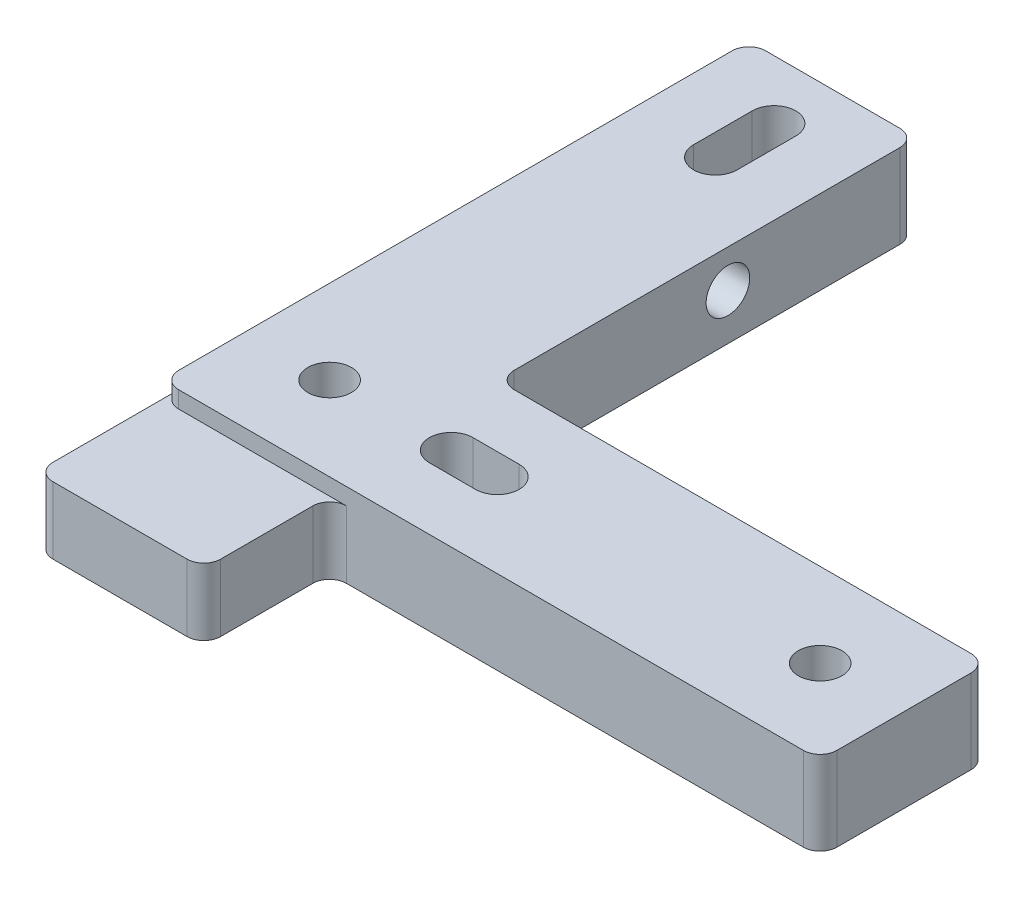
from build123d import *

# Parameters (mm, degrees)
SKETCH1_R                          = 2.6
BOSS_EXTRUDE1_DEPTH                = 10
SKETCH4_R                          = 2.6
MOTOR_TENSIONING_HOLE_DEPTH        = 106.651549918
SKETCH10_W                         = 20
SKETCH10_H                         = 15
BOSS_EXTRUDE3_DEPTH                = 10
FILLET1_R                          = 2
CHAMFER2_SIZE                      = 12
CHAMFER2_SIZE2                     = 1.049863962
M5_SLOTS_FOR_ALTERNATE_PLATE_DEPTH = 106.651549918
SKETCH9_W                          = 2.238782051
SKETCH9_H                          = 0.597008547
CUT_EXTRUDE3_DEPTH                 = 0.4
SKETCH14_W                         = 22
SKETCH14_H                         = 15
CUT_EXTRUDE7_DEPTH                 = 2
FILLET4_R                          = 2


with BuildPart() as part:
    # Sketch1 → Boss-Extrude1 (new body)
    with BuildSketch(Plane(origin=(0, 0, 0), x_dir=(1, 0, 0), z_dir=(0, 1, 0))):
        Polygon((0, 0), (78.5, 0), (78.5, 20), (20, 20), (20, 70), (0, 70), align=None)
        with Locations(Location((10, 56, 0), (0, 0, 270))):
            Circle(SKETCH1_R, mode=Mode.SUBTRACT)
        with Locations(Location((68.5, 10, 0), (0, 0, 270))):
            Circle(SKETCH1_R, mode=Mode.SUBTRACT)
        with Locations(Location((10, 10, 0), (0, 0, 270))):
            Circle(SKETCH1_R, mode=Mode.SUBTRACT)
        with Locations(Location((30, 10, 0), (0, 0, 270))):
            Circle(SKETCH1_R, mode=Mode.SUBTRACT)
    extrude(amount=BOSS_EXTRUDE1_DEPTH)

    # Sketch4 → motor tensioning hole (cut, through all)
    with BuildSketch(Plane.ZY):
        with Locations((-47.5, 5.5)):
            Circle(SKETCH4_R)
    extrude(amount=-MOTOR_TENSIONING_HOLE_DEPTH, mode=Mode.SUBTRACT)

    # Sketch10 → Boss-Extrude3 (add)
    with BuildSketch(Plane(origin=(0, 10, 0), x_dir=(1, 0, 0), z_dir=(0, 1, 0))):
        with Locations((10, -7.5)):
            Rectangle(SKETCH10_W, SKETCH10_H)
    extrude(amount=-BOSS_EXTRUDE3_DEPTH)

    # Fillet1
    fillet1_edges = [part.edges().sort_by_distance(p)[0] for p in [
        (0, 5, -70),
        (20, 5, -70),
        (20, 5, -20),
        (78.5, 5, -20),
        (78.5, 5, 0),
        (0, 5, 15),
        (20, 5, 0),
        (20, 5, 15),
    ]]
    fillet(fillet1_edges, radius=FILLET1_R)

    # Chamfer2
    chamfer2_edges = [part.edges().sort_by_distance(p)[0] for p in [
        (0, 5.5, -50.1),
    ]]
    chamfer2_side = [part.faces().sort_by_distance(p)[0] for p in [
        (10, 5.5, -50.1),
    ]]
    chamfer(chamfer2_edges, length=CHAMFER2_SIZE, length2=CHAMFER2_SIZE2, reference=chamfer2_side[0])

    # Sketch15 → M5 Slots for Alternate Plate (cut, through all)
    with BuildSketch(Plane(origin=(0, 10, 0), x_dir=(1, 0, 0), z_dir=(0, 1, 0))):
        with BuildLine():
            Line((7.4, 56), (7.4, 63))
            ThreePointArc((7.4, 63), (10, 65.6), (12.6, 63))
            Line((12.6, 63), (12.6, 56))
            ThreePointArc((12.6, 56), (10, 53.4), (7.4, 56))
        make_face()
        with BuildLine():
            Line((30, 7.4), (24.5, 7.4))
            ThreePointArc((24.5, 7.4), (21.9, 10), (24.5, 12.6))
            Line((24.5, 12.6), (30, 12.6))
            ThreePointArc((30, 12.6), (32.6, 10), (30, 7.4))
        make_face()
    extrude(amount=-M5_SLOTS_FOR_ALTERNATE_PLATE_DEPTH, mode=Mode.SUBTRACT)

    # Sketch9 → Cut-Extrude3 (cut)
    # profile 1 of 6: a face of its own
    with BuildSketch(Plane.ZY):
        with BuildLine():
            Line((-2.626697292, 7.820833333), (-2.626697292, 7.223824786))
            Line((-2.626697292, 7.223824786), (-4.606620169, 7.223824786))
            Line((-4.606620169, 7.223824786), (-4.920282863, 5.692824352))
            add(Edge.make_bspline(
                [(-4.920282863, 5.692824352), (-4.858655414, 5.709838269), (-4.73926198, 5.742800041), (-4.56304064, 5.779397733), (-4.395746226, 5.801459429), (-4.287187068, 5.804471811), (-4.234655859, 5.805929487)],
                knots=[0, 0, 0, 0, 1.100273476, 2.13160584, 3.095893838, 4, 4, 4, 4], degree=3))
            add(Edge.make_bspline(
                [(-4.234655859, 5.805929487), (-4.169655878, 5.804522616), (-4.041849674, 5.801756354), (-3.854852997, 5.775193648), (-3.676348173, 5.733383575), (-3.506708517, 5.674974803), (-3.345620197, 5.600285639), (-3.194565312, 5.506986096), (-3.051276497, 5.397997925), (-2.91832435, 5.272691994), (-2.797709518, 5.134785448), (-2.691660604, 4.986507418), (-2.601583058, 4.829298913), (-2.529137374, 4.6616579), (-2.471287714, 4.485437737), (-2.432783741, 4.298784263), (-2.407144286, 4.103456854), (-2.404279793, 3.969902706), (-2.402819087, 3.901798711)],
                knots=[0, 0, 0, 0, 1.052922333, 2.070308379, 3.05430497, 4.020497103, 4.973039431, 5.925935799, 6.892292201, 7.88610001, 8.88166317, 9.857072816, 10.836096531, 11.812156883, 12.81219415, 13.836441305, 14.89672472, 16, 16, 16, 16], degree=3))
            add(Edge.make_bspline(
                [(-2.402819087, 3.901798711), (-2.403925171, 3.854363542), (-2.40612239, 3.76013425), (-2.417296041, 3.620194431), (-2.438809369, 3.483217195), (-2.467693548, 3.349184372), (-2.505183736, 3.218349714), (-2.550568032, 3.090338732), (-2.606108806, 2.965948178), (-2.667030272, 2.844001063), (-2.735627093, 2.727254259), (-2.811761111, 2.618073743), (-2.892197529, 2.51482167), (-2.978747309, 2.418605402), (-3.072214916, 2.330057192), (-3.171468385, 2.248651538), (-3.275715717, 2.173011755), (-3.386569733, 2.10620822), (-3.501560267, 2.044735304), (-3.622347909, 1.994304374), (-3.746183145, 1.949216983), (-3.874848302, 1.913278281), (-4.00805194, 1.88511783), (-4.146013632, 1.865991236), (-4.288009818, 1.852060423), (-4.384261476, 1.851188367), (-4.432881354, 1.850747863)],
                knots=[0, 0, 0, 0, 1.056347294, 2.098418968, 3.122841568, 4.141288669, 5.149314143, 6.15115421, 7.162517403, 8.180376062, 9.185164535, 10.17417709, 11.141909838, 12.097768115, 13.052685741, 14.0056014, 14.954263652, 15.917497458, 16.885230207, 17.854509472, 18.828990115, 19.81800267, 20.826176721, 21.857883937, 22.917946725, 24, 24, 24, 24], degree=3))
            add(Edge.make_bspline(
                [(-4.432881354, 1.850747863), (-4.490880437, 1.851896793), (-4.604986783, 1.854157175), (-4.77216206, 1.877803871), (-4.93300766, 1.911671003), (-5.086228792, 1.962622037), (-5.23319862, 2.026463764), (-5.371938545, 2.107150778), (-5.505993627, 2.198586264), (-5.629914241, 2.30648847), (-5.744927444, 2.424428003), (-5.847883864, 2.55241589), (-5.939576253, 2.688339735), (-6.018536268, 2.832859642), (-6.085888334, 2.985595865), (-6.13879969, 3.147120665), (-6.181505239, 3.316590077), (-6.199572142, 3.433262046), (-6.208748574, 3.492521368)],
                knots=[0, 0, 0, 0, 1.0467383, 2.05933395, 3.04377827, 4.011590433, 4.970194871, 5.932262533, 6.905835911, 7.896367577, 8.894135286, 9.877477877, 10.858688626, 11.851381753, 12.8477658, 13.868841284, 14.917554742, 16, 16, 16, 16], degree=3))
            Line((-6.208748574, 3.492521368), (-5.686366096, 3.492521368))
            add(Edge.make_bspline(
                [(-5.686366096, 3.492521368), (-5.673512769, 3.437013148), (-5.648807961, 3.330323269), (-5.594581495, 3.180426264), (-5.528280747, 3.046847746), (-5.449442801, 2.927820713), (-5.355394715, 2.824028607), (-5.248076129, 2.731532136), (-5.127754975, 2.648086117), (-4.994053378, 2.578530872), (-4.853001149, 2.519210338), (-4.705372825, 2.479709008), (-4.555188097, 2.451933832), (-4.45360895, 2.449153535), (-4.402564513, 2.44775641)],
                knots=[0, 0, 0, 0, 1.136247022, 2.183929868, 3.172523383, 4.106158343, 5.02341133, 5.958108904, 6.928429099, 7.938127109, 8.96079061, 9.975095812, 10.982467395, 12, 12, 12, 12], degree=3))
            add(Edge.make_bspline(
                [(-4.402564513, 2.44775641), (-4.352740767, 2.449121442), (-4.254637403, 2.451809201), (-4.110261799, 2.472496463), (-3.970873007, 2.504357328), (-3.837846415, 2.552038028), (-3.708854188, 2.609988113), (-3.587159239, 2.684353543), (-3.469241001, 2.769936454), (-3.358764689, 2.867986945), (-3.25758289, 2.976037735), (-3.168181341, 3.091585257), (-3.09371307, 3.214848631), (-3.030957653, 3.343693863), (-2.983304488, 3.479533082), (-2.94930919, 3.62172968), (-2.92934696, 3.770634879), (-2.92660089, 3.872198957), (-2.925201566, 3.923953325)],
                knots=[0, 0, 0, 0, 1.027316725, 2.022795036, 3.002884548, 3.971462791, 4.93288096, 5.914575861, 6.907176829, 7.935150275, 8.956128384, 9.956726525, 10.942570165, 11.921478529, 12.907843606, 13.90538589, 14.932640048, 16, 16, 16, 16], degree=3))
            add(Edge.make_bspline(
                [(-2.925201566, 3.923953325), (-2.92629668, 3.970645974), (-2.92844021, 4.062040191), (-2.945953551, 4.195751728), (-2.976416421, 4.322268442), (-3.018698754, 4.442201281), (-3.07238265, 4.555663364), (-3.137985624, 4.662771786), (-3.216738835, 4.76211484), (-3.306698797, 4.853739003), (-3.405250563, 4.938298873), (-3.514089739, 5.010384217), (-3.630938689, 5.071027184), (-3.754389583, 5.123361463), (-3.887378825, 5.160948655), (-4.027272795, 5.189167864), (-4.175582154, 5.205491747), (-4.276982215, 5.207756697), (-4.329104477, 5.20892094)],
                knots=[0, 0, 0, 0, 1.045622112, 2.046656509, 3.013763289, 3.955457236, 4.890082067, 5.820317437, 6.762574623, 7.722996705, 8.69280354, 9.665887285, 10.63943826, 11.638615906, 12.663482002, 13.728887084, 14.832589034, 16, 16, 16, 16], degree=3))
            add(Edge.make_bspline(
                [(-4.329104477, 5.20892094), (-4.374222469, 5.207955362), (-4.467379677, 5.205961687), (-4.610277521, 5.191282383), (-4.760441256, 5.16760108), (-4.917295244, 5.135027285), (-5.081310541, 5.092400363), (-5.252141025, 5.041319223), (-5.430145877, 4.980247042), (-5.550084521, 4.93412573), (-5.611740027, 4.910416667)],
                knots=[0, 0, 0, 0, 0.817624296, 1.688186739, 2.600797293, 3.572016777, 4.590301741, 5.671205678, 6.80286297, 8, 8, 8, 8], degree=3))
            Line((-5.611740027, 4.910416667), (-5.01473148, 7.820833333))
            Line((-5.01473148, 7.820833333), (-2.626697292, 7.820833333))
        make_face()
    # profile 2 of 6: a face of its own
    with BuildSketch(Plane.ZY):
        with BuildLine():
            add(Edge.make_bspline(
                [(-10.760938745, 4.908084602), (-10.76039322, 5.0013799), (-10.759333529, 5.182607362), (-10.74754481, 5.446681344), (-10.727961294, 5.694416492), (-10.701123306, 5.925824662), (-10.668463475, 6.140965597), (-10.624864624, 6.339264354), (-10.575283094, 6.521638723), (-10.517819086, 6.688683416), (-10.452978679, 6.842648953), (-10.382406462, 6.986382294), (-10.303301679, 7.11966596), (-10.220185313, 7.244627261), (-10.129692856, 7.359220668), (-10.034399511, 7.465064477), (-9.930585985, 7.559712475), (-9.821781292, 7.645937813), (-9.707000339, 7.721524613), (-9.589514857, 7.78810287), (-9.468516187, 7.844980507), (-9.343673976, 7.889701862), (-9.216110317, 7.926640616), (-9.085379278, 7.951901282), (-8.95126501, 7.967795331), (-8.86074035, 7.969314848), (-8.814830806, 7.97008547)],
                knots=[0, 0, 0, 0, 1.646270934, 3.197905019, 4.663502075, 6.030701355, 7.308322542, 8.50163776, 9.611534131, 10.641858119, 11.616356847, 12.558055219, 13.465016945, 14.349605745, 15.204443733, 16.039544428, 16.859896111, 17.680448484, 18.487036065, 19.28249412, 20.06191084, 20.843045899, 21.620316918, 22.403196591, 23.190181807, 24, 24, 24, 24], degree=3))
            add(Edge.make_bspline(
                [(-8.814830806, 7.97008547), (-8.768537754, 7.969274187), (-8.676475439, 7.9676608), (-8.540367101, 7.952154196), (-8.407403166, 7.926424245), (-8.2781505, 7.889967576), (-8.151547397, 7.844738576), (-8.02858411, 7.788048454), (-7.908496856, 7.722058718), (-7.793193985, 7.64451877), (-7.681409678, 7.558067294), (-7.575889673, 7.460339379), (-7.476624365, 7.35232181), (-7.382367934, 7.235170282), (-7.295794519, 7.106637826), (-7.21334918, 6.968959967), (-7.139554258, 6.819728993), (-7.068482423, 6.66143481), (-7.007135851, 6.489697511), (-6.951810917, 6.305485165), (-6.907108632, 6.106621904), (-6.86987314, 5.894151101), (-6.841026926, 5.667292465), (-6.820017639, 5.426532295), (-6.808919664, 5.171712193), (-6.80682965, 4.997489913), (-6.805757121, 4.908084602)],
                knots=[0, 0, 0, 0, 0.810914788, 1.612654377, 2.396697861, 3.181598691, 3.963628158, 4.749916497, 5.551656086, 6.361998678, 7.18212741, 8.025565596, 8.878627764, 9.750805457, 10.657531673, 11.591944965, 12.560506719, 13.57287815, 14.630710178, 15.753379473, 16.941251878, 18.199788006, 19.531962791, 20.947069417, 22.433333509, 24, 24, 24, 24], degree=3))
            add(Edge.make_bspline(
                [(-6.805757121, 4.908084602), (-6.806840769, 4.819069246), (-6.808952211, 4.645626454), (-6.819893227, 4.391952915), (-6.841444665, 4.152470455), (-6.868403419, 3.926604722), (-6.905741509, 3.715295801), (-6.951651529, 3.517812474), (-7.002625935, 3.333301917), (-7.065548801, 3.163275688), (-7.134418756, 3.00536193), (-7.209349838, 2.857900018), (-7.289627156, 2.719586553), (-7.377087248, 2.59152864), (-7.470309412, 2.472819135), (-7.571288878, 2.365553446), (-7.677179124, 2.267146984), (-7.789292392, 2.179582313), (-7.906393508, 2.102938894), (-8.026068306, 2.034396335), (-8.150440195, 1.979127198), (-8.276690665, 1.931670708), (-8.406625579, 1.89541448), (-8.540082969, 1.870345223), (-8.676383994, 1.852763232), (-8.768522074, 1.851421979), (-8.814830806, 1.850747863)],
                knots=[0, 0, 0, 0, 1.561518951, 3.042555995, 4.452378317, 5.7783523, 7.031515105, 8.214008947, 9.334062868, 10.386615937, 11.391082383, 12.354592575, 13.286541444, 14.194233754, 15.072674879, 15.931287219, 16.775624067, 17.606195743, 18.42308326, 19.229000347, 20.022332153, 20.807536673, 21.593273796, 22.3848459, 23.188221202, 24, 24, 24, 24], degree=3))
            add(Edge.make_bspline(
                [(-8.814830806, 1.850747863), (-8.860739076, 1.851523457), (-8.951261225, 1.853052776), (-9.08539389, 1.868875017), (-9.215585049, 1.894312896), (-9.342477143, 1.929930748), (-9.466721193, 1.973528518), (-9.586624184, 2.030329346), (-9.703519296, 2.095745649), (-9.817094657, 2.170244701), (-9.925216073, 2.255597548), (-10.028491968, 2.350001966), (-10.124327863, 2.455813758), (-10.213526472, 2.571362162), (-10.298301235, 2.695584137), (-10.376282728, 2.830175729), (-10.448412589, 2.974603261), (-10.51434349, 3.129799834), (-10.572799065, 3.298030113), (-10.62443436, 3.481218687), (-10.665203739, 3.680982429), (-10.700100392, 3.895716908), (-10.728247253, 4.126344861), (-10.747463196, 4.372991495), (-10.759339883, 4.63550311), (-10.760396066, 4.815566056), (-10.760938745, 4.908084602)],
                knots=[0, 0, 0, 0, 0.810891512, 1.598919785, 2.382837074, 3.152667961, 3.926044502, 4.706494248, 5.493654104, 6.291793342, 7.103789334, 7.925228297, 8.761435821, 9.622817696, 10.50288917, 11.416980706, 12.369136599, 13.353924996, 14.394355917, 15.514179734, 16.714354668, 17.994756427, 19.357759367, 20.818452758, 22.365282078, 24, 24, 24, 24], degree=3))
        make_face()
        with BuildLine():
            add(Edge.make_bspline(
                [(-10.238556267, 4.910416667), (-10.238357615, 4.832669128), (-10.237972071, 4.681776423), (-10.227900032, 4.462508523), (-10.214179111, 4.257997155), (-10.19648162, 4.067982643), (-10.170199812, 3.893108158), (-10.140751737, 3.732170958), (-10.104915212, 3.586022744), (-10.062514569, 3.453660635), (-10.014219785, 3.332838315), (-9.961489914, 3.220411056), (-9.904843688, 3.115050752), (-9.841447911, 3.017703787), (-9.772404407, 2.928052702), (-9.699272689, 2.844510718), (-9.619323403, 2.770009072), (-9.508721345, 2.680656195), (-9.362707447, 2.588322588), (-9.178735094, 2.507918436), (-8.989693635, 2.457389517), (-8.861383758, 2.450963723), (-8.797340321, 2.44775641)],
                knots=[0, 0, 0, 0, 1.459021318, 2.831673884, 4.118529203, 5.306027144, 6.411944654, 7.436330062, 8.375795394, 9.233974572, 10.042671642, 10.816086306, 11.563610507, 12.285937304, 12.993564865, 13.685989202, 14.367179055, 15.041617293, 16.353048772, 17.594441528, 18.799311195, 20, 20, 20, 20], degree=3))
            add(Edge.make_bspline(
                [(-8.797340321, 2.44775641), (-8.732882622, 2.450413672), (-8.604100305, 2.455722709), (-8.415948029, 2.506943942), (-8.23328983, 2.584227212), (-8.090143996, 2.675610147), (-7.981240289, 2.762637142), (-7.903212867, 2.836835552), (-7.831596579, 2.919916917), (-7.763672319, 3.009556579), (-7.701374308, 3.107467127), (-7.644724066, 3.213177743), (-7.593029499, 3.326981983), (-7.563577669, 3.406427609), (-7.548519708, 3.447046107)],
                knots=[0, 0, 0, 0, 1.353760809, 2.704726607, 4.075137775, 5.516104923, 6.260822281, 7.007110065, 7.778089737, 8.566572457, 9.372053459, 10.217411131, 11.088608312, 12, 12, 12, 12], degree=3))
            add(Edge.make_bspline(
                [(-7.548519708, 3.447046107), (-7.530971113, 3.498984138), (-7.49533994, 3.604440615), (-7.44941893, 3.768028736), (-7.41325426, 3.939664762), (-7.38071852, 4.118322962), (-7.358511116, 4.305320893), (-7.340636479, 4.500079963), (-7.330107944, 4.702747014), (-7.328802828, 4.840442969), (-7.3281396, 4.910416667)],
                knots=[0, 0, 0, 0, 0.884706709, 1.796334032, 2.740027952, 3.714592787, 4.726048262, 5.777819803, 6.87074269, 8, 8, 8, 8], degree=3))
            add(Edge.make_bspline(
                [(-7.3281396, 4.910416667), (-7.329054617, 4.980379046), (-7.330844586, 5.117240417), (-7.33768654, 5.317673629), (-7.355354556, 5.508044417), (-7.374977614, 5.689172906), (-7.40391085, 5.860056445), (-7.435106869, 6.022125583), (-7.477018885, 6.173372495), (-7.521789035, 6.316165156), (-7.573029657, 6.448881245), (-7.629434753, 6.57213953), (-7.689674987, 6.686535078), (-7.75510488, 6.791754027), (-7.824947701, 6.888267673), (-7.901046863, 6.974140922), (-7.980383778, 7.05203526), (-8.091507122, 7.140948604), (-8.236985197, 7.231606746), (-8.418005874, 7.315037182), (-8.606385743, 7.362948116), (-8.73373469, 7.369703089), (-8.797340321, 7.373076923)],
                knots=[0, 0, 0, 0, 1.31362396, 2.569729283, 3.763502607, 4.902122613, 5.988968491, 7.01645872, 7.998833611, 8.933434873, 9.825090667, 10.667526885, 11.477055099, 12.250526234, 12.991942729, 13.710640831, 14.402115721, 15.076753259, 16.378508321, 17.609869233, 18.806226677, 20, 20, 20, 20], degree=3))
            add(Edge.make_bspline(
                [(-8.797340321, 7.373076923), (-8.861719723, 7.369698434), (-8.990595809, 7.362935301), (-9.180933658, 7.315215687), (-9.363382442, 7.232039362), (-9.508475818, 7.140648333), (-9.619676663, 7.053604736), (-9.697979666, 6.978122741), (-9.771398955, 6.895556291), (-9.839033214, 6.805080726), (-9.902379319, 6.707847252), (-9.960556074, 6.603090937), (-10.012972395, 6.490280918), (-10.061342749, 6.36951287), (-10.103872731, 6.237162181), (-10.138954001, 6.091193985), (-10.171362826, 5.930768672), (-10.194305672, 5.754947062), (-10.214701466, 5.564884957), (-10.227808898, 5.359863036), (-10.238005763, 5.140227394), (-10.23836909, 4.988554508), (-10.238556267, 4.910416667)],
                knots=[0, 0, 0, 0, 1.207732386, 2.417664972, 3.655092373, 4.956220595, 5.625982001, 6.301752483, 6.994047911, 7.697131622, 8.419323945, 9.170223765, 9.943494443, 10.752040957, 11.610060368, 12.549350801, 13.567764191, 14.679664412, 15.874934091, 17.154273443, 18.533957287, 20, 20, 20, 20], degree=3))
        make_face(mode=Mode.SUBTRACT)
    # profile 3 of 6: a face of its own
    with BuildSketch(Plane.ZY):
        with Locations((-12.328086182, 4.238782052)):
            Rectangle(SKETCH9_W, SKETCH9_H)
    # profile 4 of 6: a face of its own
    with BuildSketch(Plane.ZY):
        with BuildLine():
            Line((-17.551910968, 3.122889123), (-17.059845329, 3.417895299))
            add(Edge.make_bspline(
                [(-17.059845329, 3.417895299), (-17.01407988, 3.34128584), (-16.926395045, 3.194505072), (-16.780123558, 2.996167593), (-16.628560848, 2.827592673), (-16.47058454, 2.689760982), (-16.307158909, 2.581245869), (-16.137217096, 2.504407157), (-15.961331785, 2.456483446), (-15.841632465, 2.450662469), (-15.781873908, 2.44775641)],
                knots=[0, 0, 0, 0, 1.272034388, 2.437168799, 3.508375237, 4.49857839, 5.41946034, 6.295179144, 7.148887113, 8, 8, 8, 8], degree=3))
            add(Edge.make_bspline(
                [(-15.781873908, 2.44775641), (-15.730838737, 2.449177812), (-15.629661389, 2.451995744), (-15.480710849, 2.479072269), (-15.336051828, 2.520669821), (-15.198665796, 2.580243442), (-15.070448447, 2.652319471), (-14.958012074, 2.73937615), (-14.860810621, 2.836843851), (-14.78129951, 2.945581433), (-14.720297118, 3.062525548), (-14.673411024, 3.182561029), (-14.647391776, 3.307573517), (-14.643472271, 3.391743537), (-14.641494301, 3.434219752)],
                knots=[0, 0, 0, 0, 1.095163259, 2.171163733, 3.241058638, 4.321873601, 5.38011039, 6.391990106, 7.366004449, 8.327778327, 9.272591725, 10.192022065, 11.087607919, 12, 12, 12, 12], degree=3))
            add(Edge.make_bspline(
                [(-14.641494301, 3.434219752), (-14.64394622, 3.48268376), (-14.648930613, 3.581204007), (-14.691059277, 3.726557954), (-14.75733237, 3.870403335), (-14.818472147, 3.959381035), (-14.850214086, 4.005575588)],
                knots=[0, 0, 0, 0, 0.938893495, 1.908633276, 2.914225137, 4, 4, 4, 4], degree=3))
            add(Edge.make_bspline(
                [(-14.850214086, 4.005575588), (-14.87627581, 4.038915364), (-14.930989139, 4.108908056), (-15.025049669, 4.213093048), (-15.135422837, 4.320559633), (-15.258331488, 4.435411422), (-15.398252827, 4.552306722), (-15.55080442, 4.676819799), (-15.719881099, 4.804215517), (-15.838458953, 4.889652986), (-15.899643172, 4.933737313)],
                knots=[0, 0, 0, 0, 0.722233717, 1.516239348, 2.393582979, 3.351407094, 4.387010283, 5.505090956, 6.712668013, 8, 8, 8, 8], degree=3))
            add(Edge.make_bspline(
                [(-15.899643172, 4.933737313), (-15.960884985, 4.977357952), (-16.077974667, 5.060757293), (-16.241720667, 5.184531965), (-16.388146994, 5.2976954), (-16.516602835, 5.401312906), (-16.627031688, 5.495398536), (-16.720303742, 5.579048799), (-16.794042985, 5.654525983), (-16.835047564, 5.703489738), (-16.853457609, 5.725473257)],
                knots=[0, 0, 0, 0, 1.452282411, 2.77665338, 3.964542531, 5.026858415, 5.96415736, 6.766646006, 7.446254459, 8, 8, 8, 8], degree=3))
            add(Edge.make_bspline(
                [(-16.853457609, 5.725473257), (-16.879189925, 5.759734744), (-16.929795979, 5.827114554), (-16.996595871, 5.932429824), (-17.05337255, 6.040237088), (-17.097880857, 6.150826044), (-17.135360735, 6.262644134), (-17.160569818, 6.377150312), (-17.176354915, 6.493830777), (-17.177971421, 6.572351325), (-17.178780626, 6.611657819)],
                knots=[0, 0, 0, 0, 1.068054152, 2.10047183, 3.106115577, 4.101338837, 5.06977816, 6.043150881, 7.020423561, 8, 8, 8, 8], degree=3))
            add(Edge.make_bspline(
                [(-17.178780626, 6.611657819), (-17.176609939, 6.673241861), (-17.172314962, 6.795093629), (-17.135992102, 6.973096093), (-17.078660396, 7.143041837), (-16.998341398, 7.303248356), (-16.894801491, 7.44954416), (-16.774982174, 7.583612067), (-16.6322695, 7.696317673), (-16.475684721, 7.794792965), (-16.304292159, 7.871870653), (-16.124693002, 7.930014093), (-15.9366018, 7.962958775), (-15.809203492, 7.967686563), (-15.744560874, 7.97008547)],
                knots=[0, 0, 0, 0, 1.005424448, 1.989358655, 2.955360095, 3.929531133, 4.905563448, 5.876582895, 6.856512386, 7.866279853, 8.892233794, 9.918561126, 10.94386622, 12, 12, 12, 12], degree=3))
            add(Edge.make_bspline(
                [(-15.744560874, 7.97008547), (-15.675968007, 7.967719631), (-15.539558688, 7.963014733), (-15.338907552, 7.922106696), (-15.145721218, 7.854417602), (-14.990316169, 7.777601465), (-14.868689421, 7.700880527), (-14.775934055, 7.630997558), (-14.681940152, 7.550545145), (-14.58594953, 7.459308994), (-14.489588695, 7.356451957), (-14.391427073, 7.242678466), (-14.291235116, 7.118683813), (-14.22678043, 7.030166399), (-14.193737891, 6.984788161)],
                knots=[0, 0, 0, 0, 1.286793592, 2.559021753, 3.825965368, 5.121522368, 5.803751409, 6.523245864, 7.299691795, 8.125521123, 9.008227632, 9.944561021, 10.946284179, 12, 12, 12, 12], degree=3))
            Line((-14.193737891, 6.984788161), (-14.66598098, 6.626816239))
            add(Edge.make_bspline(
                [(-14.66598098, 6.626816239), (-14.694496298, 6.663551835), (-14.749410135, 6.734296004), (-14.832780246, 6.833368775), (-14.911359247, 6.923868563), (-14.988776995, 7.002474972), (-15.060944737, 7.073492687), (-15.13098939, 7.134295044), (-15.197902947, 7.185477791), (-15.28225, 7.240099759), (-15.388218634, 7.294244325), (-15.521240535, 7.340061065), (-15.660252471, 7.36759371), (-15.75493187, 7.371234039), (-15.80286249, 7.373076923)],
                knots=[0, 0, 0, 0, 1.181633172, 2.275549214, 3.290209073, 4.226197932, 5.078386478, 5.862611352, 6.581680152, 7.217281963, 8.414376989, 9.595101626, 10.782541182, 12, 12, 12, 12], degree=3))
            add(Edge.make_bspline(
                [(-15.80286249, 7.373076923), (-15.86299423, 7.371061751), (-15.978952627, 7.36717568), (-16.143582817, 7.324733514), (-16.2917545, 7.257907254), (-16.419068706, 7.164250082), (-16.525069369, 7.053286717), (-16.601747138, 6.925596169), (-16.647898304, 6.784594959), (-16.65353001, 6.686236751), (-16.656398147, 6.636144498)],
                knots=[0, 0, 0, 0, 1.14458467, 2.207223713, 3.21896685, 4.227309161, 5.202851033, 6.127160689, 7.046193047, 8, 8, 8, 8], degree=3))
            add(Edge.make_bspline(
                [(-16.656398147, 6.636144498), (-16.65574434, 6.604959003), (-16.654435657, 6.542537019), (-16.636183523, 6.450316024), (-16.612734996, 6.358327998), (-16.575577072, 6.266986512), (-16.524278394, 6.174694108), (-16.456914429, 6.079861528), (-16.372074433, 5.981652912), (-16.30708564, 5.917777792), (-16.272773514, 5.884053653)],
                knots=[0, 0, 0, 0, 0.858281714, 1.717966888, 2.583508476, 3.4729293, 4.427298488, 5.488583878, 6.674047936, 8, 8, 8, 8], degree=3))
            add(Edge.make_bspline(
                [(-16.272773514, 5.884053653), (-16.260031922, 5.872683027), (-16.229760816, 5.845669025), (-16.174419783, 5.80144353), (-16.101338724, 5.746889395), (-16.012425992, 5.679388823), (-15.906042177, 5.601087867), (-15.782175582, 5.512987705), (-15.642206938, 5.412228317), (-15.542883704, 5.341783693), (-15.490365829, 5.30453559)],
                knots=[0, 0, 0, 0, 0.420754252, 0.999615792, 1.744751191, 2.668019286, 3.750313428, 4.999500688, 6.413464383, 8, 8, 8, 8], degree=3))
            add(Edge.make_bspline(
                [(-15.490365829, 5.30453559), (-15.427191637, 5.258565377), (-15.304863571, 5.16955043), (-15.130808048, 5.035811495), (-14.972990608, 4.905012766), (-14.830857161, 4.777989531), (-14.703003541, 4.65570531), (-14.590848188, 4.536688925), (-14.493248313, 4.421793039), (-14.388175256, 4.27448841), (-14.280809453, 4.093575106), (-14.188604946, 3.871920703), (-14.130465885, 3.649404679), (-14.12286302, 3.499847786), (-14.119111822, 3.426057525)],
                knots=[0, 0, 0, 0, 1.163667725, 2.253281268, 3.268753668, 4.215851969, 5.092017293, 5.902905408, 6.650798638, 7.335211899, 8.59617414, 9.77448103, 10.901945474, 12, 12, 12, 12], degree=3))
            add(Edge.make_bspline(
                [(-14.119111822, 3.426057525), (-14.120204706, 3.373872316), (-14.122369249, 3.270515298), (-14.147250674, 3.118749414), (-14.183705164, 2.971347837), (-14.238649231, 2.83013257), (-14.305710483, 2.692520149), (-14.390804826, 2.562120344), (-14.489439154, 2.436047083), (-14.602585785, 2.317662158), (-14.726396411, 2.20898521), (-14.857254888, 2.112311045), (-14.995375402, 2.031703607), (-15.140008669, 1.96592679), (-15.291187912, 1.914481404), (-15.448862286, 1.877206668), (-15.613291699, 1.854329611), (-15.7250525, 1.851955108), (-15.781873908, 1.850747863)],
                knots=[0, 0, 0, 0, 0.983748083, 1.948392443, 2.894712957, 3.844097841, 4.80183111, 5.778335162, 6.776009319, 7.81870978, 8.863265674, 9.881300176, 10.883814829, 11.87499822, 12.874611388, 13.892143829, 14.928324115, 16, 16, 16, 16], degree=3))
            add(Edge.make_bspline(
                [(-15.781873908, 1.850747863), (-15.825838401, 1.851598007), (-15.9132137, 1.853287588), (-16.042451969, 1.868224312), (-16.169079357, 1.889357436), (-16.291506919, 1.922908835), (-16.411311996, 1.963616379), (-16.527973527, 2.013739297), (-16.641548054, 2.073805643), (-16.752672058, 2.142483201), (-16.861062917, 2.222407808), (-16.965703984, 2.315497063), (-17.070028594, 2.419183575), (-17.170957514, 2.536283048), (-17.270532255, 2.664903645), (-17.366789563, 2.806248752), (-17.461721895, 2.95954847), (-17.521286429, 3.067425285), (-17.551910968, 3.122889123)],
                knots=[0, 0, 0, 0, 0.915332311, 1.819136955, 2.706846663, 3.586547465, 4.459518054, 5.340707479, 6.227863349, 7.133153174, 8.059268498, 9.028702269, 10.047606654, 11.120612155, 12.245963614, 13.433783089, 14.680604001, 16, 16, 16, 16], degree=3))
        make_face()
    # profile 5 of 6: a face of its own
    with BuildSketch(Plane.ZY):
        Polygon((-24.641387463, 2), (-23.872972165, 7.820833333), (-23.798346097, 7.820833333), (-21.395153489, 3.044764957), (-18.997791042, 7.820833333), (-18.921998942, 7.820833333), (-18.148919515, 2), (-18.673634058, 2), (-19.230997506, 6.188388088), (-21.332187744, 2), (-21.449957008, 2), (-23.559309472, 6.197716346), (-24.115506888, 2), align=None)
    # profile 6 of 6: a face of its own
    with BuildSketch(Plane.ZY):
        Polygon((-28.074186609, 7.820833333), (-27.55180413, 7.820833333), (-27.55180413, 2.597008547), (-25.313022079, 2.597008547), (-25.313022079, 2), (-28.074186609, 2), align=None)
    extrude(amount=-CUT_EXTRUDE3_DEPTH, mode=Mode.SUBTRACT)

    # Sketch14 → Cut-Extrude7 (cut)
    with BuildSketch(Plane(origin=(0, 10, 0), x_dir=(1, 0, 0), z_dir=(0, 1, 0))):
        with Locations((11, -7.5)):
            Rectangle(SKETCH14_W, SKETCH14_H)
    extrude(amount=-CUT_EXTRUDE7_DEPTH, mode=Mode.SUBTRACT)

    # Fillet4
    fillet4_edges = [part.edges().sort_by_distance(p)[0] for p in [
        (0, 9, 0),
    ]]
    fillet(fillet4_edges, radius=FILLET4_R)


solid = part.part
